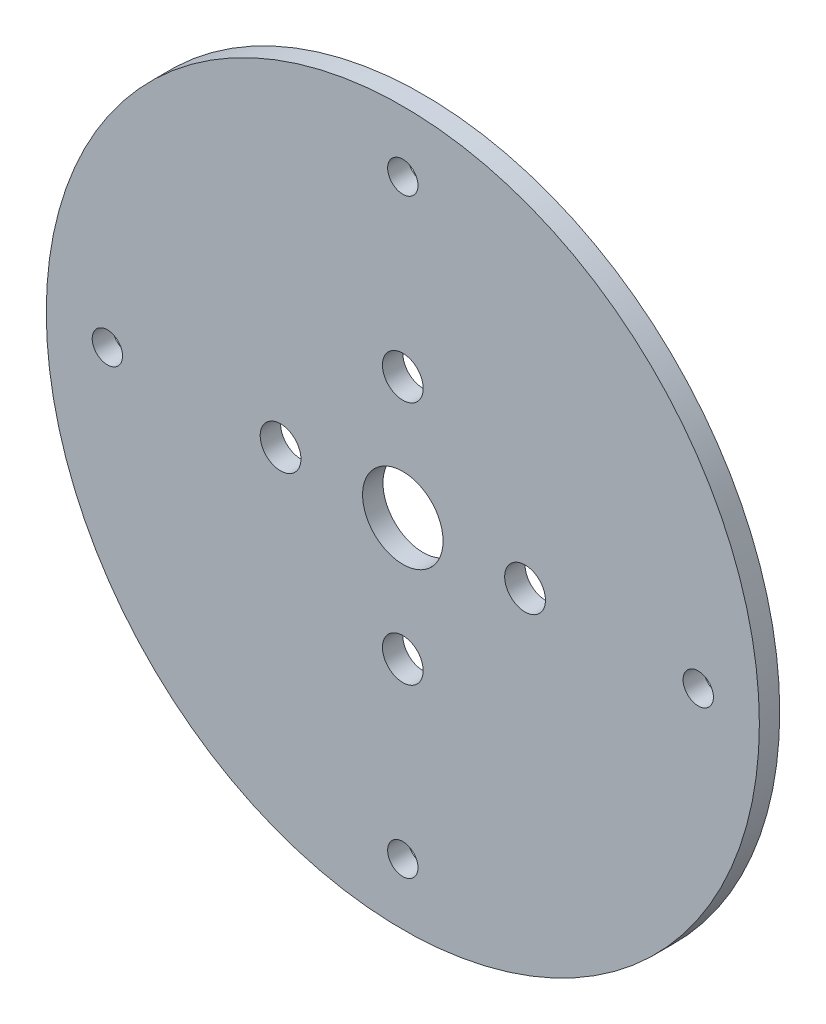
from build123d import *

# Parameters (mm, degrees)
SKETCH1_R           = 35
SKETCH1_R_2         = 3.95
SKETCH1_R_3         = 1.49
SKETCH1_R_4         = 2
BOSS_EXTRUDE1_DEPTH = 2


with BuildPart() as part:
    # Sketch1 → Boss-Extrude1 (new body)
    with BuildSketch(Plane.XY):
        Circle(SKETCH1_R)
        Circle(SKETCH1_R_2, mode=Mode.SUBTRACT)
        with Locations((-29, 0)):
            Circle(SKETCH1_R_3, mode=Mode.SUBTRACT)
        with Locations((29, 0)):
            Circle(SKETCH1_R_3, mode=Mode.SUBTRACT)
        with Locations((0, 29)):
            Circle(SKETCH1_R_3, mode=Mode.SUBTRACT)
        with Locations((0, -29)):
            Circle(SKETCH1_R_3, mode=Mode.SUBTRACT)
        with Locations((0, 12)):
            Circle(SKETCH1_R_4, mode=Mode.SUBTRACT)
        with Locations((12, 0)):
            Circle(SKETCH1_R_4, mode=Mode.SUBTRACT)
        with Locations((0, -12)):
            Circle(SKETCH1_R_4, mode=Mode.SUBTRACT)
        with Locations((-12, 0)):
            Circle(SKETCH1_R_4, mode=Mode.SUBTRACT)
    extrude(amount=BOSS_EXTRUDE1_DEPTH)


solid = part.part
